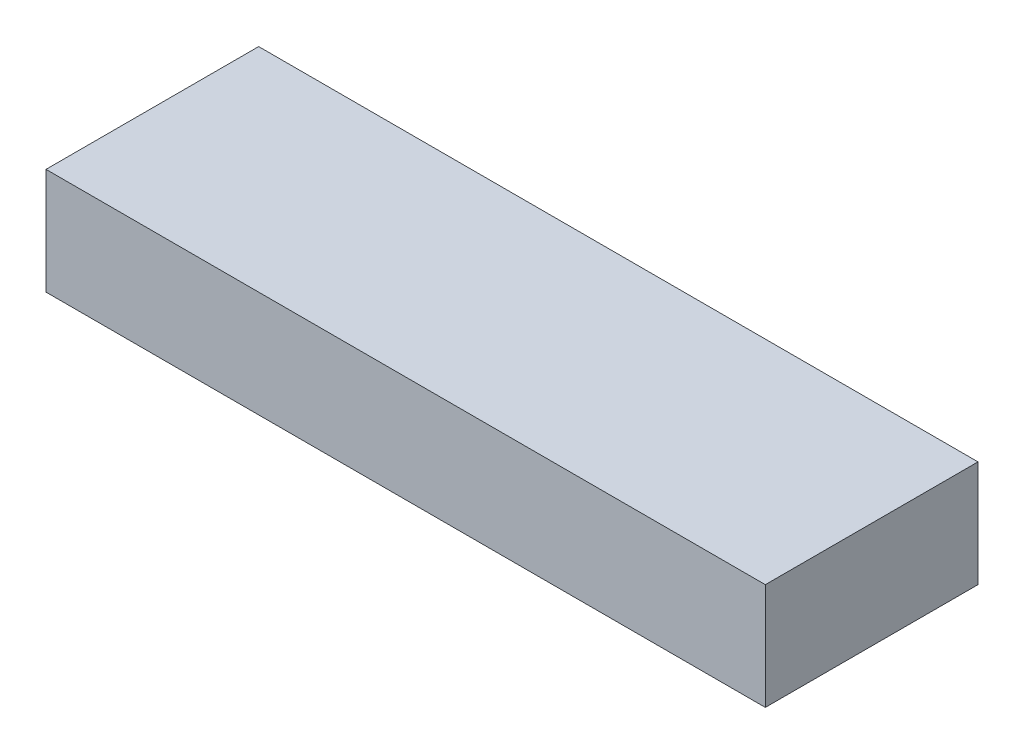
from build123d import *

# Parameters (mm, degrees)
SKETCH1_W           = 146.05
SKETCH1_H           = 43.18
BOSS_EXTRUDE1_DEPTH = 21.59


with BuildPart() as part:
    # Sketch1 → Boss-Extrude1 (new body)
    with BuildSketch(Plane(origin=(0, 0, 0), x_dir=(1, 0, 0), z_dir=(0, 1, 0))):
        Rectangle(SKETCH1_W, SKETCH1_H)
    extrude(amount=BOSS_EXTRUDE1_DEPTH)


solid = part.part
